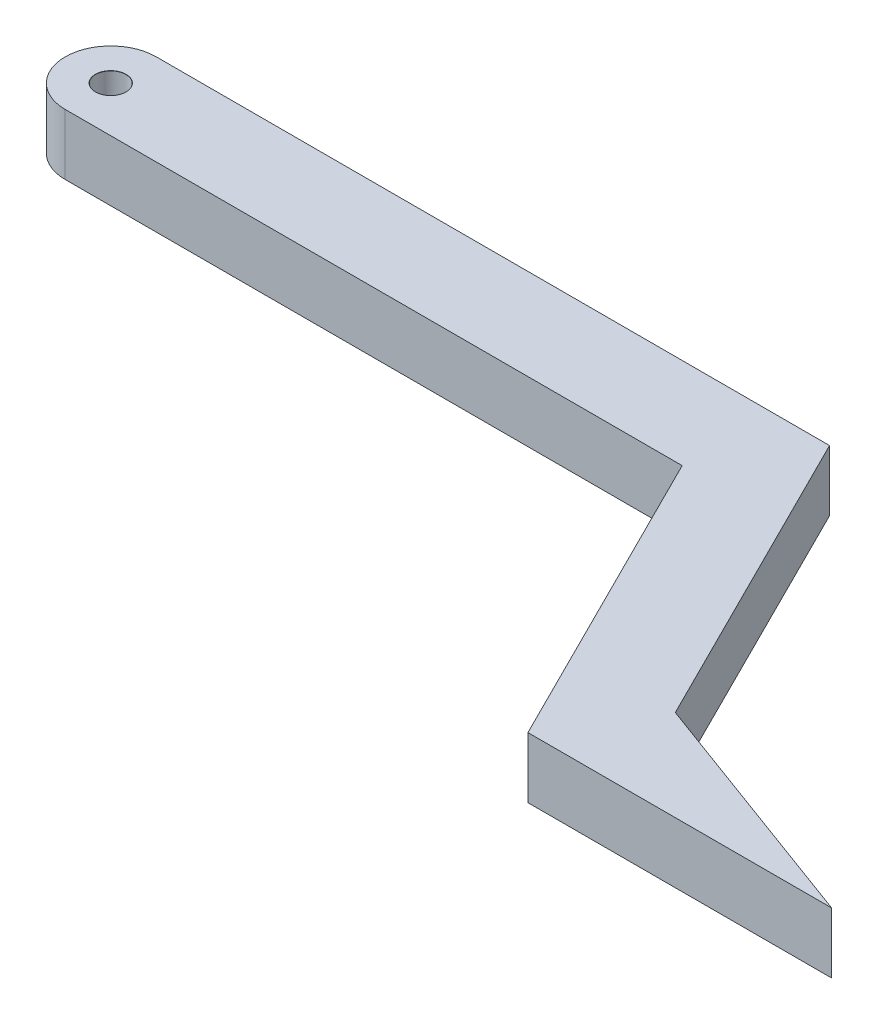
from build123d import *

# Parameters (mm, degrees)
BOSS_EXTRUDE1_DEPTH             = 10
BOSS_EXTRUDE2_DEPTH             = 10
F_5_0MM_DOWEL_HOLE2_D           = 5
F_5_0MM_DOWEL_HOLE2_CSINK_D     = 5.05
F_5_0MM_DOWEL_HOLE2_CSINK_ANGLE = 90


with BuildPart() as part:
    # Sketch1 → Boss-Extrude1 (new body)
    with BuildSketch(Plane(origin=(0, 0, 0), x_dir=(1, 0, 0), z_dir=(0, 1, 0))):
        Polygon((0, 0), (101.6, 0), (126.970266889, -50.770266889), (176.970266889, -50.770266889), (136.243205185, -35.770266889), (110.872938296, 15), (0, 15), align=None)
    extrude(amount=BOSS_EXTRUDE1_DEPTH)

    # Sketch2 → Boss-Extrude2 (add)
    with BuildSketch(Plane(origin=(0, 10, 0), x_dir=(1, 0, 0), z_dir=(0, 1, 0))):
        with BuildLine():
            Line((0, 15), (0, 0))
            ThreePointArc((0, 0), (-7.5, 7.5), (0, 15))
        make_face()
    extrude(amount=-BOSS_EXTRUDE2_DEPTH)

    # Ø5.0mm Dowel Hole2 (through all)
    with Locations(Plane(origin=(0, 10, 0), x_dir=(1, 0, 0), z_dir=(0, 1, 0))):
        with Locations((0, 7.5)):
            CounterSinkHole(F_5_0MM_DOWEL_HOLE2_D / 2, F_5_0MM_DOWEL_HOLE2_CSINK_D / 2, counter_sink_angle=F_5_0MM_DOWEL_HOLE2_CSINK_ANGLE)


solid = part.part
